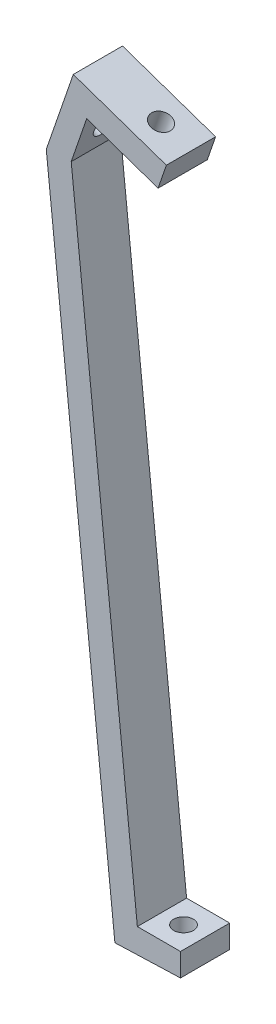
from build123d import *

# Parameters (mm, degrees)
SALIENTE_EXTRUIR1_DEPTH = 3
CORTAR_EXTRUIR1_REACH   = 102.701
CROQUIS2_R              = 1.2
CORTAR_EXTRUIR2_REACH   = 99.382
CROQUIS3_R              = 1.2
SALIENTE_EXTRUIR2_DEPTH = 6
CORTAR_EXTRUIR3_REACH   = 94.93
CROQUIS5_R              = 1.2


with BuildPart() as part:
    # Croquis1 → Saliente-Extruir1 (new, symmetric)
    with BuildSketch(Plane.XY):
        Polygon((36.601721277, 88.42375405), (39.249173289, 87.512163218), (37.360877993, 82.028155479), (45.422960067, 5.322568365), (50.680147873, 5.322568365), (50.680147873, 2.522568365), (42.685021257, 2.243372391), (34.322744196, 81.805124021), align=None)
    extrude(amount=SALIENTE_EXTRUIR1_DEPTH, both=True)

    # Croquis2 → Cortar-Extruir1 (cut, up to next)
    with BuildSketch(Plane(origin=(8.150038197, -2.806283201, 0), x_dir=(0, 0, -1), z_dir=(0.9455185755993173, -0.3255681544571552, 0)), mode=Mode.PRIVATE) as cortar_extruir1_sk1:
        with Locations(Location((0, 92.622656825, 0), (0, 0, 90))):
            Circle(CROQUIS2_R)
    cortar_extruir1_tool1 = extrude(cortar_extruir1_sk1.sketch, amount=-CORTAR_EXTRUIR1_REACH, mode=Mode.PRIVATE) & part.part
    add(cortar_extruir1_tool1.solids().sort_by_distance((38.305026, 84.770159, 0))[0], mode=Mode.SUBTRACT)

    # Cortar-Extruir2: up to this plane
    cortar_extruir2_end = Plane(origin=(42.685021257, 2.243372391, 3), z_dir=(-0.03489949670250159, 0.9993908270190958, 0))
    # Croquis3 → Cortar-Extruir2 (cut, up to the surface)
    with BuildSketch(Plane(origin=(0, 5.322568365, 0), x_dir=(1, 0, 0), z_dir=(0, 1, 0)), mode=Mode.PRIVATE) as cortar_extruir2_sk1:
        with Locations(Location((48.05155397, 0, 0), (0, 0, 180))):
            Circle(CROQUIS3_R)
    cortar_extruir2_tool1 = split(extrude(cortar_extruir2_sk1.sketch, amount=-CORTAR_EXTRUIR2_REACH, mode=Mode.PRIVATE), bisect_by=cortar_extruir2_end, keep=Keep.BOTH, mode=Mode.PRIVATE)
    add(cortar_extruir2_tool1.solids().sort_by_distance((48.051554, 5.322568, 0))[0], mode=Mode.SUBTRACT)

    # Croquis4 → Saliente-Extruir2 (add)
    with BuildSketch(Plane.XY.offset(3)):
        Polygon((36.601721277, 88.42375405), (37.610982556, 91.354861634), (48.957205463, 87.448043781), (47.947944184, 84.516936196), align=None)
    extrude(amount=-SALIENTE_EXTRUIR2_DEPTH)

    # Croquis5 → Cortar-Extruir3 (cut, up to next)
    with BuildSketch(Plane(origin=(32.10839637, 93.249554003, 0), x_dir=(0.9455185755993183, -0.3255681544571526, 0), z_dir=(0.3255681544571526, 0.9455185755993183, 0)), mode=Mode.PRIVATE) as cortar_extruir3_sk1:
        with Locations(Location((13.95964895, 0, 0), (0, 0, 180))):
            Circle(CROQUIS5_R)
    cortar_extruir3_tool1 = extrude(cortar_extruir3_sk1.sketch, amount=-CORTAR_EXTRUIR3_REACH, mode=Mode.PRIVATE) & part.part
    add(cortar_extruir3_tool1.solids().sort_by_distance((45.307504, 88.704737, 0))[0], mode=Mode.SUBTRACT)


solid = part.part
